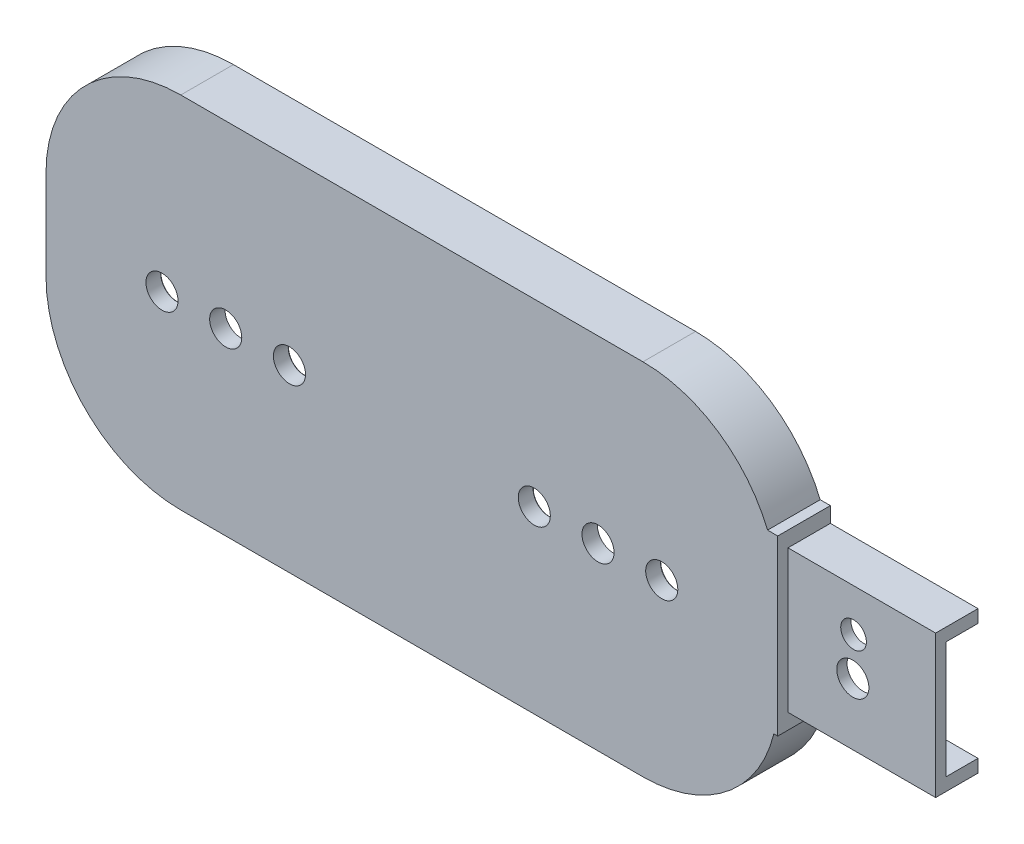
from build123d import *

# Parameters (mm, degrees)
SKETCH_1_W          = 114
SKETCH_1_H          = 56
SKETCH_1_W_2        = 110
SKETCH_1_H_2        = 52
EXTRUDE_1_DEPTH     = 7
SKETCH_2_W          = 114
SKETCH_2_H          = 56
EXTRUDE_1_2_DEPTH   = 1.2
SKETCH_3_R          = 2.5
CUT_EXTRUDE_1_DEPTH = 1.2
FILLET_1_R          = 20
FILLET_2_R          = 21
SKETCH_4_W          = 33.86
SKETCH_4_H          = 14
EXTRUDE_2_DEPTH     = 1.2
SKETCH_5_R          = 2.5
CUT_EXTRUDE_2_DEPTH = 1.2
FILLET_3_R          = 0.1
SKETCH_6_W          = 25
SKETCH_6_H          = 22.2
EXTRUDE_3_DEPTH     = 7
CUT_EXTRUDE_3_DEPTH = 0.4
SKETCH_8_W          = 27
SKETCH_8_H          = 18.2
CUT_EXTRUDE_4_DEPTH = 5
SKETCH_11_W         = 2
SKETCH_11_H         = 27
EXTRUDE_4_DEPTH     = 8.2
SKETCH_12_W         = 2
SKETCH_12_H         = 18.2
CUT_EXTRUDE_5_DEPTH = 5
SKETCH_13_R         = 2.5
SKETCH_13_R_2       = 2
CUT_EXTRUDE_6_DEPTH = 7


with BuildPart() as part:
    # Эскиз1 → Extrude 1 (new body)
    with BuildSketch(Plane.XY):
        Rectangle(SKETCH_1_W, SKETCH_1_H)
        Rectangle(SKETCH_1_W_2, SKETCH_1_H_2, mode=Mode.SUBTRACT)
    extrude(amount=EXTRUDE_1_DEPTH)

    # Эскиз2 → Extrude 1 2 (add)
    with BuildSketch(Plane.XY.offset(7)):
        Rectangle(SKETCH_2_W, SKETCH_2_H)
    extrude(amount=EXTRUDE_1_2_DEPTH)

    # Эскиз3 → Вырез-Вытянуть1 (cut)
    with BuildSketch(Plane.XY.offset(8.2)):
        with Locations((-38.93, 0)):
            Circle(SKETCH_3_R)
        with Locations((-29, 0)):
            Circle(SKETCH_3_R)
        with Locations((-19.07, 0)):
            Circle(SKETCH_3_R)
        with Locations((19.07, 0)):
            Circle(SKETCH_3_R)
        with Locations((29, 0)):
            Circle(SKETCH_3_R)
        with Locations((38.93, 0)):
            Circle(SKETCH_3_R)
    extrude(amount=-CUT_EXTRUDE_1_DEPTH, mode=Mode.SUBTRACT)

    # Скругление1
    fillet_1_edges = [part.edges().sort_by_distance(p)[0] for p in [
        (-55, 26, 3.5),
        (-55, -26, 3.5),
        (55, -26, 3.5),
        (55, 26, 3.5),
    ]]
    fillet(fillet_1_edges, radius=FILLET_1_R)

    # Скругление2
    fillet_2_edges = [part.edges().sort_by_distance(p)[0] for p in [
        (-57, 28, 4.1),
        (57, 28, 4.1),
        (57, -28, 4.1),
        (-57, -28, 4.1),
    ]]
    fillet(fillet_2_edges, radius=FILLET_2_R)

    # Эскиз4 → Бобышка-Вытянуть2 (add)
    with BuildSketch(Plane(origin=(0, 0, 7), x_dir=(-1, 0, 0), z_dir=(0, 0, -1))):
        with Locations((29, 0)):
            Rectangle(SKETCH_4_W, SKETCH_4_H)
        with Locations((-29, 0)):
            Rectangle(SKETCH_4_W, SKETCH_4_H)
    extrude(amount=EXTRUDE_2_DEPTH)

    # Эскиз5 → Вырез-Вытянуть2 (cut)
    with BuildSketch(Plane.XY.offset(7)):
        with Locations((-29, 0)):
            Circle(SKETCH_5_R)
        with Locations((-38.93, 0)):
            Circle(SKETCH_5_R)
        with Locations((-19.07, 0)):
            Circle(SKETCH_5_R)
        with Locations((19.07, 0)):
            Circle(SKETCH_5_R)
        with Locations((29, 0)):
            Circle(SKETCH_5_R)
        with Locations((38.93, 0)):
            Circle(SKETCH_5_R)
    extrude(amount=-CUT_EXTRUDE_2_DEPTH, mode=Mode.SUBTRACT)

    # Скругление3
    fillet_3_edges = [part.edges().sort_by_distance(p)[0] for p in [
        (36.43, 0, 5.8),
        (16.57, 0, 5.8),
        (-21.57, 0, 5.8),
        (-41.43, 0, 5.8),
    ]]
    fillet(fillet_3_edges, radius=FILLET_3_R)

    # Эскиз6 → Бобышка-Вытянуть3 (add)
    with BuildSketch(Plane(origin=(0, 0, 7), x_dir=(-1, 0, 0), z_dir=(0, 0, -1))):
        with Locations((-67.5, 1.5)):
            Rectangle(SKETCH_6_W, SKETCH_6_H)
    extrude(amount=EXTRUDE_3_DEPTH)

    # Эскиз7 → Вырез-Вытянуть3 (cut)
    with BuildSketch(Plane.XY.offset(7)):
        with BuildLine():
            Line((57, 7), (57, -7))
            ThreePointArc((57, -7), (56.959567588, -8.302507787), (56.838426044, -9.6))
            Line((56.838426044, -9.6), (80, -9.6))
            Line((80, -9.6), (80, 12.6))
            Line((80, 12.6), (56.239565213, 12.6))
            ThreePointArc((56.239565213, 12.6), (56.809022916, 9.825697306), (57, 7))
        make_face()
    extrude(amount=-CUT_EXTRUDE_3_DEPTH, mode=Mode.SUBTRACT)

    # Эскиз8 → Вырез-Вытянуть4 (cut)
    with BuildSketch(Plane(origin=(0, 0, 0), x_dir=(-1, 0, 0), z_dir=(0, 0, -1))):
        with Locations((-66.5, 1.5)):
            Rectangle(SKETCH_8_W, SKETCH_8_H)
    extrude(amount=-CUT_EXTRUDE_4_DEPTH, mode=Mode.SUBTRACT)

    # Эскиз11 → Бобышка-Вытянуть4 (add)
    with BuildSketch(Plane.XY.offset(8.2)):
        with Locations((56, 1.5)):
            Rectangle(SKETCH_11_W, SKETCH_11_H)
    extrude(amount=-EXTRUDE_4_DEPTH)

    # Эскиз12 → Вырез-Вытянуть5 (cut)
    with BuildSketch(Plane(origin=(0, 0, 0), x_dir=(-1, 0, 0), z_dir=(0, 0, -1))):
        with Locations((-56, 1.5)):
            Rectangle(SKETCH_12_W, SKETCH_12_H)
    extrude(amount=-CUT_EXTRUDE_5_DEPTH, mode=Mode.SUBTRACT)

    # Эскиз13 → Вырез-Вытянуть6 (cut)
    with BuildSketch(Plane(origin=(0, 0, 5), x_dir=(-1, 0, 0), z_dir=(0, 0, -1))):
        with Locations((-67.1, 0)):
            Circle(SKETCH_13_R)
        with Locations((-67.210919407, 6)):
            Circle(SKETCH_13_R_2)
    extrude(amount=-CUT_EXTRUDE_6_DEPTH, mode=Mode.SUBTRACT)


solid = part.part
